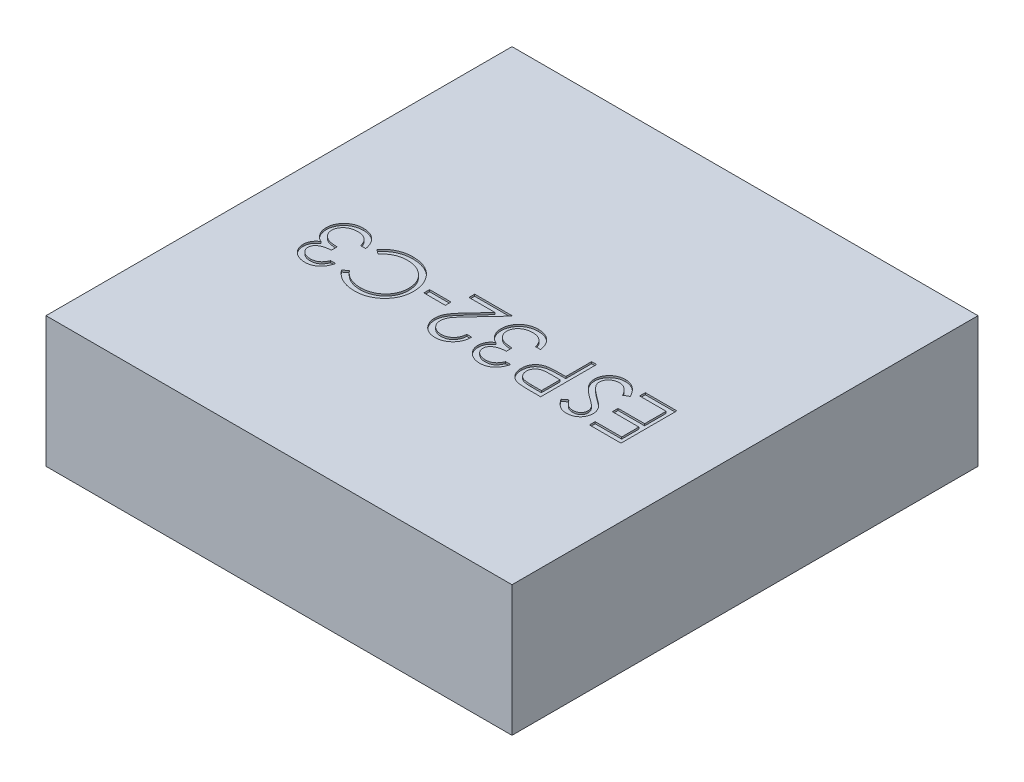
from build123d import *

# Parameters (mm, degrees)
BASES_W          = 5
BASES_H          = 5
BASE_DEPTH       = 1.4
PARTNUMBERS_W    = 0.230769231
PARTNUMBERS_H    = 0.061538462
PARTNUMBER_DEPTH = 0.02


with BuildPart() as part:
    # BaseS → Base (new body)
    with BuildSketch(Plane(origin=(0, 0, 0), x_dir=(1, 0, 0), z_dir=(0, 1, 0))):
        Rectangle(BASES_W, BASES_H)
    extrude(amount=BASE_DEPTH)

    # PartNumberS → PartNumber (cut)
    # profile 1 of 8: a face of its own
    with BuildSketch(Plane(origin=(0, 1.4, 0), x_dir=(1, 0, 0), z_dir=(0, 1, 0))):
        Polygon((1.769230769, -0.6), (1.430769231, -0.6), (1.430769231, -0.538461538), (1.715384615, -0.538461538), (1.715384615, -0.353846154), (1.430769231, -0.353846154), (1.430769231, -0.292307692), (1.715384615, -0.292307692), (1.715384615, -0.061538462), (1.430769231, -0.061538462), (1.430769231, 0), (1.769230769, 0), align=None)
    # profile 2 of 8: a face of its own
    with BuildSketch(Plane(origin=(0, 1.4, 0), x_dir=(1, 0, 0), z_dir=(0, 1, 0))):
        with BuildLine():
            Line((1.384615385, -0.115745192), (1.333894231, -0.146153846))
            add(Edge.make_bspline(
                [(1.333894231, -0.146153846), (1.329176819, -0.138257094), (1.320138439, -0.123127223), (1.305061063, -0.102682987), (1.289438279, -0.085306618), (1.273154393, -0.071099199), (1.256308802, -0.059913676), (1.238791535, -0.051993293), (1.220661625, -0.047053412), (1.208323255, -0.046453397), (1.202163462, -0.046153846)],
                knots=[0, 0, 0, 0, 1.272034388, 2.437168799, 3.508375237, 4.49857839, 5.41946034, 6.295179144, 7.148887113, 8, 8, 8, 8], degree=3))
            add(Edge.make_bspline(
                [(1.202163462, -0.046153846), (1.196903921, -0.046303847), (1.186476871, -0.046601224), (1.171096496, -0.049343192), (1.156233778, -0.053829033), (1.142036643, -0.059910127), (1.128880563, -0.06738493), (1.117160746, -0.076199768), (1.107258313, -0.086382722), (1.099071687, -0.097566638), (1.092663061, -0.109518059), (1.08810317, -0.121942657), (1.085173996, -0.134761256), (1.084802618, -0.143454003), (1.084615385, -0.147836538)],
                knots=[0, 0, 0, 0, 1.095645842, 2.172120455, 3.244862764, 4.326153987, 5.384857088, 6.392105572, 7.372507978, 8.334705661, 9.272564127, 10.189475455, 11.087205874, 12, 12, 12, 12], degree=3))
            add(Edge.make_bspline(
                [(1.084615385, -0.147836538), (1.084862695, -0.15283378), (1.085363526, -0.162953739), (1.089777384, -0.177910096), (1.096517161, -0.192775056), (1.102851793, -0.201971722), (1.106129808, -0.206730769)],
                knots=[0, 0, 0, 0, 0.938992559, 1.901562324, 2.914110574, 4, 4, 4, 4], degree=3))
            add(Edge.make_bspline(
                [(1.106129808, -0.206730769), (1.108808199, -0.210174828), (1.114447651, -0.217426423), (1.124285468, -0.228031117), (1.135471687, -0.23925953), (1.148295921, -0.250887546), (1.162571166, -0.263153024), (1.178459264, -0.275828487), (1.195774696, -0.289102984), (1.207987774, -0.297870407), (1.214302885, -0.302403846)],
                knots=[0, 0, 0, 0, 0.722283655, 1.520795216, 2.39349503, 3.346893347, 4.386874146, 5.510198126, 6.712579003, 8, 8, 8, 8], degree=3))
            add(Edge.make_bspline(
                [(1.214302885, -0.302403846), (1.220614728, -0.306901205), (1.232682491, -0.315499812), (1.249571991, -0.328244955), (1.264654673, -0.339971896), (1.27800739, -0.350517281), (1.28928469, -0.360341047), (1.298898841, -0.368916696), (1.30649514, -0.376702156), (1.310722301, -0.381748665), (1.312620192, -0.384014423)],
                knots=[0, 0, 0, 0, 1.452255772, 2.776602448, 3.96446981, 5.032613149, 5.964194703, 6.766668629, 7.446264616, 8, 8, 8, 8], degree=3))
            add(Edge.make_bspline(
                [(1.312620192, -0.384014423), (1.315272184, -0.387546205), (1.320487682, -0.394491927), (1.327379618, -0.405345119), (1.333191606, -0.416433991), (1.33786917, -0.427798731), (1.341651739, -0.439353928), (1.344281595, -0.451186332), (1.345902583, -0.463215619), (1.346070026, -0.471309081), (1.346153846, -0.475360577)],
                knots=[0, 0, 0, 0, 1.068019517, 2.100403715, 3.106014851, 4.09224787, 5.069873182, 6.043214339, 7.020455327, 8, 8, 8, 8], degree=3))
            add(Edge.make_bspline(
                [(1.346153846, -0.475360577), (1.345931082, -0.481709082), (1.345490315, -0.494270398), (1.341731921, -0.512610649), (1.335869839, -0.53017497), (1.32738875, -0.546572444), (1.316913018, -0.561779825), (1.304478304, -0.575527348), (1.289851741, -0.587341806), (1.273568642, -0.59738504), (1.255953684, -0.6053973), (1.237441396, -0.611235535), (1.218114963, -0.614657097), (1.204981368, -0.615139727), (1.198317308, -0.615384615)],
                knots=[0, 0, 0, 0, 1.005367131, 1.989245246, 2.955191616, 3.932180104, 4.904534562, 5.875498653, 6.859376768, 7.874484044, 8.900379497, 9.918679785, 10.943926428, 12, 12, 12, 12], degree=3))
            add(Edge.make_bspline(
                [(1.198317308, -0.615384615), (1.191244705, -0.61514861), (1.177218889, -0.614680582), (1.156581543, -0.610360924), (1.136593341, -0.603649303), (1.120574367, -0.595655893), (1.108032547, -0.587758416), (1.098478119, -0.580546834), (1.088743297, -0.572262478), (1.07893297, -0.562729845), (1.068950209, -0.55213985), (1.058841021, -0.540402772), (1.048510795, -0.527624405), (1.041867307, -0.518499815), (1.038461538, -0.513822115)],
                knots=[0, 0, 0, 0, 1.286534051, 2.551350862, 3.822568981, 5.117864672, 5.799956111, 6.519305446, 7.295594771, 8.126302591, 9.008831062, 9.944975596, 10.946496709, 12, 12, 12, 12], degree=3))
            Line((1.038461538, -0.513822115), (1.087139423, -0.476923077))
            add(Edge.make_bspline(
                [(1.087139423, -0.476923077), (1.090078511, -0.480709929), (1.095738509, -0.48800252), (1.104334986, -0.498211829), (1.112425093, -0.507550252), (1.120456807, -0.515640046), (1.127811016, -0.523087098), (1.135075558, -0.529349613), (1.141969792, -0.534626408), (1.150640059, -0.540265114), (1.161651322, -0.545720603), (1.175344867, -0.550411024), (1.189664456, -0.553293566), (1.199385708, -0.553659933), (1.204326923, -0.553846154)],
                knots=[0, 0, 0, 0, 1.181426797, 2.275151783, 3.28963443, 4.225459815, 5.084396437, 5.868484344, 6.587427557, 7.222918358, 8.415355282, 9.605213164, 10.782753814, 12, 12, 12, 12], degree=3))
            add(Edge.make_bspline(
                [(1.204326923, -0.553846154), (1.210526647, -0.553641835), (1.22248223, -0.553247826), (1.239416114, -0.548831419), (1.254745505, -0.54211657), (1.267885206, -0.532433827), (1.278734453, -0.520890133), (1.286679773, -0.507725363), (1.291430139, -0.493185387), (1.292011576, -0.483047618), (1.292307692, -0.477884615)],
                knots=[0, 0, 0, 0, 1.144248881, 2.206576175, 3.214949548, 4.222996039, 5.203671638, 6.127710127, 7.046472867, 8, 8, 8, 8], degree=3))
            add(Edge.make_bspline(
                [(1.292307692, -0.477884615), (1.292233265, -0.474671658), (1.292083372, -0.468200986), (1.290296291, -0.458660661), (1.287629447, -0.449232647), (1.283849269, -0.439862626), (1.278711963, -0.430283654), (1.271734599, -0.420550329), (1.263003352, -0.410419051), (1.25630235, -0.40383615), (1.252764423, -0.400360577)],
                knots=[0, 0, 0, 0, 0.858500039, 1.728959331, 2.587258638, 3.476905708, 4.426389682, 5.487945037, 6.673710648, 8, 8, 8, 8], degree=3))
            add(Edge.make_bspline(
                [(1.252764423, -0.400360577), (1.251451045, -0.399188515), (1.248330759, -0.396403965), (1.242626315, -0.391845289), (1.235093264, -0.386221956), (1.225928315, -0.379264131), (1.214962481, -0.371193023), (1.202194557, -0.362111832), (1.187766866, -0.351725753), (1.177528823, -0.344464461), (1.172115385, -0.340625)],
                knots=[0, 0, 0, 0, 0.420754252, 0.999615792, 1.744751191, 2.668019286, 3.750313428, 4.999500688, 6.413464383, 8, 8, 8, 8], degree=3))
            add(Edge.make_bspline(
                [(1.172115385, -0.340625), (1.165603518, -0.335886478), (1.152994192, -0.326710987), (1.13505283, -0.312925487), (1.118785533, -0.299442857), (1.104133983, -0.286350074), (1.090957465, -0.273743523), (1.079388806, -0.261481311), (1.069375515, -0.249643851), (1.058448272, -0.234570693), (1.047414996, -0.215886962), (1.037954868, -0.192985549), (1.031936497, -0.170018417), (1.031154876, -0.15460169), (1.030769231, -0.146995192)],
                knots=[0, 0, 0, 0, 1.163604038, 2.253157948, 3.268574773, 4.215621239, 5.091738613, 5.902582348, 6.650434646, 7.330118262, 8.591011492, 9.77460283, 10.902005569, 12, 12, 12, 12], degree=3))
            add(Edge.make_bspline(
                [(1.030769231, -0.146995192), (1.03088206, -0.141616143), (1.031105529, -0.130962503), (1.033667677, -0.11531733), (1.03743493, -0.100128843), (1.043049568, -0.085586056), (1.050068028, -0.071526888), (1.058612948, -0.057975991), (1.068968418, -0.045156019), (1.080472102, -0.032818007), (1.093249785, -0.021659494), (1.106771182, -0.011720783), (1.120960401, -0.003211036), (1.135979481, 0.00347441), (1.151581016, 0.008822196), (1.167838241, 0.012655347), (1.184786089, 0.015015926), (1.196306338, 0.015260347), (1.202163462, 0.015384615)],
                knots=[0, 0, 0, 0, 0.98378539, 1.948466333, 2.894822735, 3.844243623, 4.795447569, 5.768042124, 6.770299647, 7.807997672, 8.852593179, 9.870666288, 10.876941106, 11.874841786, 12.874492863, 13.892063892, 14.928283473, 16, 16, 16, 16], degree=3))
            add(Edge.make_bspline(
                [(1.202163462, 0.015384615), (1.206695035, 0.01529598), (1.21570111, 0.015119826), (1.22898643, 0.013599404), (1.24202779, 0.011369685), (1.254661445, 0.007970174), (1.267044691, 0.003748512), (1.279067203, -0.001420264), (1.290757982, -0.007573575), (1.302131471, -0.014720938), (1.313291769, -0.02296017), (1.324193834, -0.032473231), (1.334892242, -0.043214587), (1.345431432, -0.055169289), (1.355563141, -0.068534941), (1.36554215, -0.083099578), (1.3753165, -0.098910254), (1.381457862, -0.110028732), (1.384615385, -0.115745192)],
                knots=[0, 0, 0, 0, 0.915366252, 1.81920441, 2.69897508, 3.586533125, 4.459536084, 5.340758185, 6.227946952, 7.126403341, 8.052553006, 9.028121456, 10.047063623, 11.114014537, 12.24582441, 13.433687931, 14.680555077, 16, 16, 16, 16], degree=3))
        make_face()
    # profile 3 of 8: a face of its own
    with BuildSketch(Plane(origin=(0, 1.4, 0), x_dir=(1, 0, 0), z_dir=(0, 1, 0))):
        with BuildLine():
            Line((0.907692308, -0.6), (0.790024038, -0.6))
            add(Edge.make_bspline(
                [(0.790024038, -0.6), (0.78193074, -0.599991104), (0.766423621, -0.599974057), (0.744186755, -0.599457244), (0.723990801, -0.598766954), (0.705879307, -0.597810058), (0.689796547, -0.596679214), (0.675815296, -0.59509315), (0.663825658, -0.593437099), (0.656641695, -0.59175343), (0.653365385, -0.590985577)],
                knots=[0, 0, 0, 0, 1.415646017, 2.712440637, 3.8905458, 4.950247383, 5.884950622, 6.709939814, 7.411656543, 8, 8, 8, 8], degree=3))
            add(Edge.make_bspline(
                [(0.653365385, -0.590985577), (0.649217948, -0.589850351), (0.641020804, -0.58760665), (0.629208815, -0.583113365), (0.617972429, -0.577783154), (0.607264643, -0.57171728), (0.597268895, -0.564629283), (0.587673098, -0.556928259), (0.57867849, -0.54830276), (0.570420887, -0.538764143), (0.562769861, -0.528624888), (0.556365404, -0.51762645), (0.550710016, -0.50615037), (0.546302721, -0.493916455), (0.542838418, -0.481086191), (0.540315362, -0.467626186), (0.53869374, -0.453565475), (0.538539869, -0.443954881), (0.538461538, -0.4390625)],
                knots=[0, 0, 0, 0, 0.999333726, 1.975119402, 2.933498163, 3.889020618, 4.832249799, 5.779334906, 6.747801194, 7.724875447, 8.710438469, 9.696133548, 10.679360639, 11.681339199, 12.714023775, 13.766351759, 14.862936069, 16, 16, 16, 16], degree=3))
            add(Edge.make_bspline(
                [(0.538461538, -0.4390625), (0.538533783, -0.434129167), (0.538675133, -0.424476767), (0.540371639, -0.410355718), (0.542656815, -0.396861137), (0.546170596, -0.384022945), (0.550772711, -0.371917385), (0.556171349, -0.360359459), (0.562682811, -0.349545801), (0.570164782, -0.339437152), (0.578487912, -0.330024024), (0.587616987, -0.321374631), (0.597515152, -0.313539602), (0.608150949, -0.306501371), (0.619628066, -0.300423152), (0.631772435, -0.294979043), (0.644689615, -0.290406861), (0.653628331, -0.288001707), (0.658173077, -0.286778846)],
                knots=[0, 0, 0, 0, 1.121902311, 2.195077645, 3.232258892, 4.234102512, 5.217864754, 6.176164875, 7.132989551, 8.084763148, 9.034132444, 9.988522005, 10.94243251, 11.903244335, 12.886203696, 13.894208494, 14.929344452, 16, 16, 16, 16], degree=3))
            add(Edge.make_bspline(
                [(0.658173077, -0.286778846), (0.661932091, -0.285980074), (0.67017019, -0.284229517), (0.683736663, -0.282261941), (0.699540084, -0.280648314), (0.717526682, -0.279142464), (0.737738403, -0.278344551), (0.760128889, -0.277407672), (0.784773919, -0.27696561), (0.801963058, -0.276937666), (0.8109375, -0.276923077)],
                knots=[0, 0, 0, 0, 0.601372724, 1.317943291, 2.144091499, 3.08771165, 4.142394186, 5.309582461, 6.595334295, 8, 8, 8, 8], degree=3))
            Line((0.8109375, -0.276923077), (0.853846154, -0.276923077))
            Line((0.853846154, -0.276923077), (0.853846154, 0))
            Line((0.853846154, 0), (0.907692308, 0))
            Line((0.907692308, 0), (0.907692308, -0.6))
        make_face()
        with BuildLine():
            Line((0.853846154, -0.538461538), (0.853846154, -0.338461538))
            Line((0.853846154, -0.338461538), (0.748798077, -0.337139423))
            add(Edge.make_bspline(
                [(0.748798077, -0.337139423), (0.74366886, -0.337136041), (0.733767014, -0.337129512), (0.719424871, -0.337824408), (0.706150706, -0.338580377), (0.693924919, -0.339802958), (0.682803313, -0.341294125), (0.67275896, -0.343287823), (0.663711702, -0.345321267), (0.653290263, -0.348849652), (0.641617158, -0.35417267), (0.628947706, -0.36212326), (0.618122698, -0.372139004), (0.608834321, -0.383522001), (0.601492493, -0.396198445), (0.596171552, -0.409723844), (0.59292376, -0.424046841), (0.59251554, -0.433837254), (0.592307692, -0.438822115)],
                knots=[0, 0, 0, 0, 1.160501667, 2.240324542, 3.248665471, 4.168823117, 5.020172044, 5.786515869, 6.485785279, 7.116517804, 8.272762037, 9.381837012, 10.485674779, 11.594342068, 12.695271952, 13.786226926, 14.872841088, 16, 16, 16, 16], degree=3))
            add(Edge.make_bspline(
                [(0.592307692, -0.438822115), (0.592524813, -0.443645481), (0.592956423, -0.453233735), (0.596144724, -0.467292837), (0.601548843, -0.480664473), (0.608840306, -0.493240445), (0.617906101, -0.504593187), (0.628515822, -0.514385717), (0.640504399, -0.522311623), (0.651569357, -0.527587824), (0.661471623, -0.530681905), (0.670031232, -0.532915675), (0.679745078, -0.534456259), (0.690521233, -0.535930308), (0.702345899, -0.537120186), (0.715294267, -0.537946475), (0.729323206, -0.538424987), (0.739062116, -0.53844906), (0.744110577, -0.538461538)],
                knots=[0, 0, 0, 0, 1.12039168, 2.227199994, 3.330242575, 4.460839274, 5.593542475, 6.693949254, 7.801736126, 8.92216649, 9.528704869, 10.210659466, 10.975987387, 11.81211542, 12.738540127, 13.736887663, 14.826846554, 16, 16, 16, 16], degree=3))
            Line((0.744110577, -0.538461538), (0.853846154, -0.538461538))
        make_face(mode=Mode.SUBTRACT)
    # profile 4 of 8: a face of its own
    with BuildSketch(Plane(origin=(0, 1.4, 0), x_dir=(1, 0, 0), z_dir=(0, 1, 0))):
        with BuildLine():
            Line((0.392307692, -0.461538462), (0.446153846, -0.461538462))
            add(Edge.make_bspline(
                [(0.446153846, -0.461538462), (0.444695066, -0.467578316), (0.44184327, -0.479385737), (0.435895115, -0.496255553), (0.429415242, -0.512219586), (0.421634253, -0.526978913), (0.413147038, -0.540830153), (0.403423143, -0.553459146), (0.392911191, -0.565187083), (0.381284056, -0.575595066), (0.369090572, -0.58501982), (0.356158922, -0.593055544), (0.342749283, -0.599968256), (0.328768746, -0.605663153), (0.314175688, -0.609953243), (0.299102039, -0.613065838), (0.283508296, -0.615087172), (0.272922995, -0.615284445), (0.267548077, -0.615384615)],
                knots=[0, 0, 0, 0, 1.162005537, 2.271625781, 3.343758855, 4.383309926, 5.390229558, 6.379919256, 7.361854164, 8.333198761, 9.295911338, 10.242430842, 11.177959212, 12.116337295, 13.062827104, 14.020064771, 14.994644689, 16, 16, 16, 16], degree=3))
            add(Edge.make_bspline(
                [(0.267548077, -0.615384615), (0.25971675, -0.615148176), (0.244224919, -0.614680454), (0.22146554, -0.610409408), (0.199518085, -0.603650814), (0.178622785, -0.594312461), (0.159213911, -0.582794636), (0.141944851, -0.569086395), (0.127049677, -0.553452229), (0.114553498, -0.53618379), (0.104769213, -0.517728559), (0.097554406, -0.498734247), (0.093162118, -0.479245909), (0.092592879, -0.466087518), (0.092307692, -0.459495192)],
                knots=[0, 0, 0, 0, 1.083050992, 2.142477498, 3.193116406, 4.255571735, 5.30263384, 6.308962982, 7.297363603, 8.282367274, 9.249857812, 10.179914175, 11.08814088, 12, 12, 12, 12], degree=3))
            add(Edge.make_bspline(
                [(0.092307692, -0.459495192), (0.092507165, -0.45315117), (0.092897502, -0.440736904), (0.096211852, -0.422613219), (0.101789497, -0.405531801), (0.109515742, -0.389420745), (0.11951715, -0.374382201), (0.13163247, -0.360382334), (0.145947212, -0.34735905), (0.15679503, -0.339898569), (0.162379808, -0.336057692)],
                knots=[0, 0, 0, 0, 1.024540389, 2.004866551, 2.965041327, 3.920577974, 4.882998113, 5.874504559, 6.905732034, 8, 8, 8, 8], degree=3))
            add(Edge.make_bspline(
                [(0.162379808, -0.336057692), (0.155989086, -0.332986893), (0.143306697, -0.32689289), (0.126194453, -0.314751726), (0.110423284, -0.301077761), (0.101731378, -0.290287643), (0.097355769, -0.284855769)],
                knots=[0, 0, 0, 0, 1.015663554, 2.015584519, 3.001021554, 4, 4, 4, 4], degree=3))
            add(Edge.make_bspline(
                [(0.097355769, -0.284855769), (0.094467507, -0.280903433), (0.088738279, -0.273063483), (0.0816865, -0.260451084), (0.075216017, -0.247740645), (0.070453929, -0.234432406), (0.066344435, -0.220953852), (0.063640525, -0.207016353), (0.061904723, -0.192752328), (0.061660981, -0.183098036), (0.061538462, -0.178245192)],
                knots=[0, 0, 0, 0, 1.02516404, 2.033540309, 3.025129118, 4.011046665, 4.991655828, 5.976607087, 6.982917762, 8, 8, 8, 8], degree=3))
            add(Edge.make_bspline(
                [(0.061538462, -0.178245192), (0.061846814, -0.169843903), (0.062462068, -0.153080861), (0.067937657, -0.128308109), (0.076478882, -0.104137356), (0.088382497, -0.080911389), (0.103176887, -0.059246716), (0.120680663, -0.039806927), (0.140912463, -0.023249456), (0.163283224, -0.00929254), (0.187613475, 0.00176816), (0.213533191, 0.00973829), (0.240888911, 0.01451925), (0.25959625, 0.015092876), (0.269110577, 0.015384615)],
                knots=[0, 0, 0, 0, 0.955619592, 1.906742024, 2.874954321, 3.868585453, 4.869520953, 5.854611167, 6.836527075, 7.836578462, 8.849204403, 9.870874567, 10.917152508, 12, 12, 12, 12], degree=3))
            add(Edge.make_bspline(
                [(0.269110577, 0.015384615), (0.27552491, 0.015234481), (0.28814618, 0.014939066), (0.306707958, 0.012955508), (0.324388499, 0.009234208), (0.341359485, 0.004554159), (0.357364784, -0.001916533), (0.372634618, -0.009630797), (0.387102053, -0.018786454), (0.400681171, -0.029398903), (0.413357466, -0.041277952), (0.424807988, -0.054620946), (0.435159423, -0.069178858), (0.444346001, -0.085082639), (0.452406383, -0.102287746), (0.459167111, -0.120863121), (0.465070062, -0.140664761), (0.467819901, -0.15446033), (0.469230769, -0.161538462)],
                knots=[0, 0, 0, 0, 1.048603596, 2.063302207, 3.045874044, 3.999447474, 4.937100059, 5.862643889, 6.7929026, 7.7308982, 8.676022965, 9.627908155, 10.600123445, 11.591992905, 12.626222643, 13.701663232, 14.820785756, 16, 16, 16, 16], degree=3))
            Line((0.469230769, -0.161538462), (0.415384615, -0.161538462))
            add(Edge.make_bspline(
                [(0.415384615, -0.161538462), (0.413981765, -0.156918631), (0.4112531, -0.147932658), (0.406608364, -0.135000035), (0.40131666, -0.123144368), (0.395639878, -0.11227869), (0.389677859, -0.102295993), (0.383006729, -0.093460244), (0.37612059, -0.085383352), (0.370929844, -0.080832847), (0.368389423, -0.078605769)],
                knots=[0, 0, 0, 0, 1.198163088, 2.33053128, 3.407730985, 4.417276592, 5.372219308, 6.28897303, 7.162600585, 8, 8, 8, 8], degree=3))
            add(Edge.make_bspline(
                [(0.368389423, -0.078605769), (0.365029635, -0.076016837), (0.358320429, -0.070846964), (0.347394364, -0.064230657), (0.335863286, -0.058567256), (0.323631036, -0.053963806), (0.310695971, -0.050508291), (0.297110563, -0.048021174), (0.28285252, -0.04637929), (0.273121684, -0.04623009), (0.268149038, -0.046153846)],
                knots=[0, 0, 0, 0, 0.946083416, 1.889246487, 2.84504177, 3.809995578, 4.801312957, 5.829064617, 6.89060985, 8, 8, 8, 8], degree=3))
            add(Edge.make_bspline(
                [(0.268149038, -0.046153846), (0.262534076, -0.046259258), (0.251554502, -0.046465382), (0.235534731, -0.048366474), (0.22028966, -0.051123116), (0.205974866, -0.05543504), (0.192395558, -0.060607905), (0.179854867, -0.067380136), (0.167984111, -0.075028275), (0.157131049, -0.083924531), (0.147346483, -0.093540422), (0.138891537, -0.103742025), (0.131568587, -0.114213024), (0.125682157, -0.125197687), (0.121025714, -0.136588262), (0.117857716, -0.148427386), (0.115654453, -0.160615364), (0.115475053, -0.168900347), (0.115384615, -0.173076923)],
                knots=[0, 0, 0, 0, 1.216990249, 2.379719373, 3.493992396, 4.571561497, 5.616923107, 6.638958652, 7.655775068, 8.674704564, 9.676001865, 10.625896028, 11.54399481, 12.441854662, 13.322657739, 14.20572845, 15.095482574, 16, 16, 16, 16], degree=3))
            add(Edge.make_bspline(
                [(0.115384615, -0.173076923), (0.1156475, -0.178667087), (0.116171962, -0.189819599), (0.120159519, -0.206233587), (0.126777141, -0.222054514), (0.135861395, -0.237075191), (0.147184759, -0.250833589), (0.16021198, -0.263148839), (0.175221016, -0.273403179), (0.189113531, -0.280468285), (0.201451058, -0.285175486), (0.211987931, -0.288476322), (0.223794826, -0.291114887), (0.236729873, -0.293667197), (0.250847666, -0.295806885), (0.266160911, -0.29759896), (0.282675774, -0.299030648), (0.294108522, -0.299670351), (0.3, -0.3)],
                knots=[0, 0, 0, 0, 1.070440979, 2.135555593, 3.216243406, 4.345886539, 5.486149072, 6.621334998, 7.769144672, 8.957074012, 9.598644492, 10.297969361, 11.070758978, 11.915404831, 12.824182859, 13.805940418, 14.869366021, 16, 16, 16, 16], degree=3))
            Line((0.3, -0.3), (0.3, -0.361538462))
            add(Edge.make_bspline(
                [(0.3, -0.361538462), (0.29257983, -0.36168313), (0.278050622, -0.361966402), (0.256767505, -0.364686989), (0.236478043, -0.369102886), (0.217487419, -0.375268052), (0.200267678, -0.382773655), (0.185185628, -0.391177062), (0.172783849, -0.400871727), (0.162840225, -0.411399368), (0.155464931, -0.422762207), (0.150020925, -0.434551438), (0.14680091, -0.446986382), (0.146370294, -0.455470881), (0.146153846, -0.459735577)],
                knots=[0, 0, 0, 0, 1.321816535, 2.58820849, 3.816448615, 5.017641336, 6.139869627, 7.160068286, 8.085608132, 8.934319198, 9.728416342, 10.48890201, 11.240453369, 12, 12, 12, 12], degree=3))
            add(Edge.make_bspline(
                [(0.146153846, -0.459735577), (0.146223325, -0.462869434), (0.14636155, -0.469104093), (0.148174365, -0.478241235), (0.150772595, -0.487099177), (0.154547298, -0.49557442), (0.159429135, -0.503693905), (0.165335432, -0.511487288), (0.17228115, -0.519028989), (0.180221183, -0.526152676), (0.189082464, -0.53256412), (0.198509335, -0.538279833), (0.208538548, -0.543085934), (0.219104745, -0.547069865), (0.230265041, -0.550061465), (0.241960725, -0.552210864), (0.254215839, -0.553554352), (0.262576696, -0.55374781), (0.266826923, -0.553846154)],
                knots=[0, 0, 0, 0, 0.884246871, 1.759167212, 2.622361933, 3.489113179, 4.372562419, 5.294145153, 6.247651513, 7.265905295, 8.30305477, 9.334068495, 10.37719476, 11.441246459, 12.52060732, 13.637552802, 14.799054011, 16, 16, 16, 16], degree=3))
            add(Edge.make_bspline(
                [(0.266826923, -0.553846154), (0.273658863, -0.553608097), (0.287003232, -0.553143118), (0.306236929, -0.549056155), (0.324098797, -0.542580784), (0.337705937, -0.534761792), (0.347770979, -0.527069999), (0.355101259, -0.52045275), (0.362168401, -0.512950144), (0.368695082, -0.504356394), (0.375072396, -0.494967005), (0.381239448, -0.484730262), (0.386998153, -0.473500221), (0.390503571, -0.465602933), (0.392307692, -0.461538462)],
                knots=[0, 0, 0, 0, 1.4727372, 2.876598283, 4.222346151, 5.558423782, 6.24313385, 6.953189256, 7.68715613, 8.463578749, 9.278833271, 10.135787152, 11.040551781, 12, 12, 12, 12], degree=3))
        make_face()
    # profile 5 of 8: a face of its own
    with BuildSketch(Plane(origin=(0, 1.4, 0), x_dir=(1, 0, 0), z_dir=(0, 1, 0))):
        with BuildLine():
            Line((-0.069230769, -0.415384615), (-0.015384615, -0.415384615))
            add(Edge.make_bspline(
                [(-0.015384615, -0.415384615), (-0.015735496, -0.422528231), (-0.016424617, -0.436558103), (-0.019653169, -0.457013132), (-0.024268546, -0.476567186), (-0.030809612, -0.495052627), (-0.038887256, -0.512690277), (-0.048776631, -0.52924593), (-0.060266911, -0.544883898), (-0.073337015, -0.559308103), (-0.087519283, -0.57249363), (-0.102728741, -0.584000501), (-0.118809064, -0.593611447), (-0.135620778, -0.601689669), (-0.153358316, -0.607745992), (-0.171852126, -0.612241659), (-0.1911858, -0.614946031), (-0.20435836, -0.615236757), (-0.211057692, -0.615384615)],
                knots=[0, 0, 0, 0, 1.100776268, 2.161895295, 3.184016182, 4.190939212, 5.176500551, 6.166955529, 7.155448256, 8.160289653, 9.16017456, 10.133824356, 11.091467644, 12.04088621, 13.000931625, 13.972173743, 14.968683325, 16, 16, 16, 16], degree=3))
            add(Edge.make_bspline(
                [(-0.211057692, -0.615384615), (-0.217637254, -0.615231844), (-0.230565857, -0.614931654), (-0.249427081, -0.612314939), (-0.267425212, -0.608305056), (-0.284356278, -0.602363041), (-0.300394039, -0.594907113), (-0.31533992, -0.585634688), (-0.329555329, -0.574984508), (-0.342342599, -0.562422099), (-0.354089248, -0.549017977), (-0.36421415, -0.534702486), (-0.372933795, -0.519899829), (-0.380070552, -0.504494373), (-0.385480531, -0.488435953), (-0.389488807, -0.471878524), (-0.391780155, -0.454631004), (-0.392129886, -0.442955258), (-0.392307692, -0.437019231)],
                knots=[0, 0, 0, 0, 1.111674182, 2.184400057, 3.212814286, 4.223731311, 5.211378316, 6.196328225, 7.191884489, 8.207283132, 9.220262353, 10.201199469, 11.166417575, 12.120932471, 13.06540007, 14.026332106, 14.996573967, 16, 16, 16, 16], degree=3))
            add(Edge.make_bspline(
                [(-0.392307692, -0.437019231), (-0.392017414, -0.428662463), (-0.391441952, -0.412095576), (-0.386519554, -0.387750118), (-0.378831326, -0.364162876), (-0.369575457, -0.345178691), (-0.360235487, -0.329882969), (-0.351827237, -0.317283009), (-0.34192801, -0.30371981), (-0.330622381, -0.289138475), (-0.31771565, -0.273729958), (-0.303543134, -0.257179885), (-0.287738821, -0.239794278), (-0.276656199, -0.227911939), (-0.270913462, -0.221754808)],
                knots=[0, 0, 0, 0, 1.184416499, 2.348048165, 3.509039915, 4.696071444, 5.333504901, 6.05069495, 6.844171097, 7.714965912, 8.667477798, 9.695072654, 10.805644396, 12, 12, 12, 12], degree=3))
            Line((-0.270913462, -0.221754808), (-0.120793269, -0.061538462))
            Line((-0.120793269, -0.061538462), (-0.4, -0.061538462))
            Line((-0.4, -0.061538462), (-0.4, 0))
            Line((-0.4, 0), (0.007692308, 0))
            Line((0.007692308, 0), (-0.225, -0.248317308))
            add(Edge.make_bspline(
                [(-0.225, -0.248317308), (-0.230665753, -0.254230981), (-0.241548505, -0.265589936), (-0.256934527, -0.282178687), (-0.270775877, -0.29755023), (-0.283081738, -0.311772681), (-0.293862233, -0.32476541), (-0.303082871, -0.336630239), (-0.310784405, -0.347265348), (-0.318946426, -0.35975903), (-0.326729455, -0.375031178), (-0.333569941, -0.393600662), (-0.337711078, -0.412758764), (-0.338210384, -0.425701321), (-0.338461538, -0.432211538)],
                knots=[0, 0, 0, 0, 1.329530082, 2.553755191, 3.672934919, 4.687409497, 5.60679272, 6.413407421, 7.126401618, 7.737995624, 8.834647426, 9.90044882, 10.943907757, 12, 12, 12, 12], degree=3))
            add(Edge.make_bspline(
                [(-0.338461538, -0.432211538), (-0.338353674, -0.436305945), (-0.338141093, -0.444375234), (-0.336229425, -0.456198301), (-0.333420805, -0.467647249), (-0.329091855, -0.47858052), (-0.32389078, -0.489213149), (-0.317246024, -0.499221873), (-0.309652813, -0.508947863), (-0.30084506, -0.518057624), (-0.291175784, -0.52640358), (-0.280959295, -0.533796122), (-0.270150793, -0.539974297), (-0.25879532, -0.545038885), (-0.246924674, -0.54901181), (-0.234515859, -0.551764709), (-0.221603171, -0.553493135), (-0.212786, -0.553726993), (-0.208293269, -0.553846154)],
                knots=[0, 0, 0, 0, 0.991504627, 1.954065223, 2.895985987, 3.842598665, 4.797835564, 5.759220273, 6.74786863, 7.784730864, 8.824135544, 9.839918996, 10.835834653, 11.835434876, 12.84861661, 13.863796685, 14.911511676, 16, 16, 16, 16], degree=3))
            add(Edge.make_bspline(
                [(-0.208293269, -0.553846154), (-0.203599928, -0.553728451), (-0.19438298, -0.553497301), (-0.180879541, -0.55174538), (-0.167907537, -0.549092184), (-0.155666865, -0.544868319), (-0.143901348, -0.539924836), (-0.132911131, -0.533523895), (-0.122387485, -0.52620983), (-0.112541991, -0.517682095), (-0.103574873, -0.508055567), (-0.095417406, -0.497577261), (-0.088505503, -0.486061418), (-0.082369876, -0.473784364), (-0.077677333, -0.460408799), (-0.073665546, -0.446261836), (-0.070751441, -0.431141634), (-0.069746079, -0.420724191), (-0.069230769, -0.415384615)],
                knots=[0, 0, 0, 0, 1.031072318, 2.024855787, 2.988461151, 3.935103592, 4.865765533, 5.788564469, 6.724086513, 7.67908574, 8.64457978, 9.611397706, 10.591395687, 11.591555111, 12.622101007, 13.700900657, 14.821571223, 16, 16, 16, 16], degree=3))
        make_face()
    # profile 6 of 8: a face of its own
    with BuildSketch(Plane(origin=(0, 1.4, 0), x_dir=(1, 0, 0), z_dir=(0, 1, 0))):
        with Locations((-0.56923077, -0.230769231)):
            Rectangle(PARTNUMBERS_W, PARTNUMBERS_H)
    # profile 7 of 8: a face of its own
    with BuildSketch(Plane(origin=(0, 1.4, 0), x_dir=(1, 0, 0), z_dir=(0, 1, 0))):
        with BuildLine():
            Line((-1.338461538, -0.489903846), (-1.291346154, -0.453846154))
            add(Edge.make_bspline(
                [(-1.291346154, -0.453846154), (-1.28798511, -0.457851696), (-1.281308336, -0.465808776), (-1.270567265, -0.476983191), (-1.259370804, -0.487448609), (-1.24773453, -0.497272272), (-1.235389154, -0.506059347), (-1.22280507, -0.514494178), (-1.209525041, -0.521879163), (-1.19125455, -0.530900846), (-1.167260438, -0.540109704), (-1.137160179, -0.548030118), (-1.105695181, -0.553024548), (-1.084233556, -0.553569148), (-1.073317308, -0.553846154)],
                knots=[0, 0, 0, 0, 0.75789156, 1.505565099, 2.245254514, 2.979266606, 3.711207489, 4.440978832, 5.174393176, 5.91211879, 7.394186119, 8.890401545, 10.418332761, 12, 12, 12, 12], degree=3))
            add(Edge.make_bspline(
                [(-1.073317308, -0.553846154), (-1.067303101, -0.553776591), (-1.055330505, -0.55363811), (-1.037561116, -0.551824014), (-1.020089882, -0.549244917), (-1.002981772, -0.545511137), (-0.986270754, -0.540650095), (-0.969829589, -0.53494939), (-0.953851905, -0.527855444), (-0.938145433, -0.520021117), (-0.923098224, -0.511169805), (-0.90885814, -0.501518227), (-0.895489405, -0.491161728), (-0.88295802, -0.480124783), (-0.871390258, -0.468278542), (-0.86066323, -0.455756106), (-0.850790627, -0.442500922), (-0.841782635, -0.428576323), (-0.833725555, -0.414051095), (-0.826738757, -0.398987627), (-0.820832862, -0.383443468), (-0.816041627, -0.36745193), (-0.812291811, -0.351069619), (-0.80969614, -0.334237878), (-0.807898757, -0.316986128), (-0.807761497, -0.305293139), (-0.807692308, -0.299399038)],
                knots=[0, 0, 0, 0, 1.054960097, 2.100129169, 3.131228542, 4.15308236, 5.169990287, 6.183953224, 7.204064171, 8.235355279, 9.262684623, 10.264978336, 11.252191258, 12.228402777, 13.192898315, 14.155264692, 15.119862721, 16.091023151, 17.063429752, 18.032246104, 19.00241354, 19.978852882, 20.959535218, 21.948948728, 22.966123959, 24, 24, 24, 24], degree=3))
            add(Edge.make_bspline(
                [(-0.807692308, -0.299399038), (-0.807909127, -0.29053101), (-0.808334822, -0.273119812), (-0.812107336, -0.247613472), (-0.817886089, -0.223154925), (-0.826405068, -0.199909777), (-0.837119035, -0.177684252), (-0.850487111, -0.156747879), (-0.866028285, -0.136793935), (-0.883901987, -0.118305692), (-0.903514931, -0.101417863), (-0.924557293, -0.086546272), (-0.946977493, -0.074149452), (-0.970527763, -0.06383357), (-0.995389385, -0.055903847), (-1.021517636, -0.050321425), (-1.048855693, -0.046679909), (-1.067536161, -0.046331277), (-1.077043269, -0.046153846)],
                knots=[0, 0, 0, 0, 1.029159485, 2.020618137, 2.987588728, 3.942669054, 4.889339625, 5.846988364, 6.821327795, 7.821533711, 8.827683044, 9.822769455, 10.807800696, 11.797391277, 12.803701919, 13.832062008, 14.896664671, 16, 16, 16, 16], degree=3))
            add(Edge.make_bspline(
                [(-1.077043269, -0.046153846), (-1.087518016, -0.046443351), (-1.108134823, -0.047013167), (-1.138369342, -0.051840466), (-1.167312616, -0.059667538), (-1.194966202, -0.070621468), (-1.221252142, -0.084861231), (-1.246211569, -0.102123724), (-1.269865553, -0.122573153), (-1.284089201, -0.138187404), (-1.291346154, -0.146153846)],
                knots=[0, 0, 0, 0, 1.028121516, 2.023589091, 2.998037872, 3.967518031, 4.937445131, 5.927275754, 6.942489185, 8, 8, 8, 8], degree=3))
            Line((-1.291346154, -0.146153846), (-1.338461538, -0.110456731))
            add(Edge.make_bspline(
                [(-1.338461538, -0.110456731), (-1.334669735, -0.105564586), (-1.327104289, -0.095803729), (-1.314856241, -0.082040477), (-1.301944474, -0.069105846), (-1.288334132, -0.057067198), (-1.274007448, -0.04586436), (-1.258970684, -0.035549422), (-1.243298837, -0.026007963), (-1.226972285, -0.01735975), (-1.209990133, -0.009664286), (-1.192497916, -0.002938467), (-1.174463589, 0.002709154), (-1.156029369, 0.007454326), (-1.137005845, 0.010843284), (-1.117610678, 0.013540377), (-1.097663288, 0.015140848), (-1.084217575, 0.015302631), (-1.077403846, 0.015384615)],
                knots=[0, 0, 0, 0, 0.986880684, 1.969034265, 2.935876267, 3.899990983, 4.864973347, 5.834408638, 6.8063673, 7.789580233, 8.778939794, 9.778051223, 10.776304221, 11.791326552, 12.811423977, 13.855999788, 14.91350973, 16, 16, 16, 16], degree=3))
            add(Edge.make_bspline(
                [(-1.077403846, 0.015384615), (-1.070950646, 0.015339702), (-1.058190242, 0.015250892), (-1.039350456, 0.013812235), (-1.021009385, 0.011849423), (-1.003219449, 0.008893972), (-0.985883568, 0.005406371), (-0.969158896, 0.000731298), (-0.95288086, -0.004505702), (-0.937114859, -0.010660842), (-0.921847482, -0.017606473), (-0.907127971, -0.025456455), (-0.892963097, -0.034144775), (-0.879213596, -0.043479919), (-0.866082582, -0.053761742), (-0.853456263, -0.064847451), (-0.841263839, -0.076699682), (-0.833720521, -0.085246228), (-0.829927885, -0.089543269)],
                knots=[0, 0, 0, 0, 1.114604814, 2.203992996, 3.262667896, 4.300477797, 5.318619304, 6.316056647, 7.298880507, 8.271930387, 9.238335007, 10.195173496, 11.151986948, 12.108099108, 13.064862484, 14.031167946, 15.010108607, 16, 16, 16, 16], degree=3))
            add(Edge.make_bspline(
                [(-0.829927885, -0.089543269), (-0.823853599, -0.097007627), (-0.811778362, -0.111846226), (-0.796322411, -0.135892985), (-0.783136312, -0.160977481), (-0.772355852, -0.187245009), (-0.764075201, -0.214705781), (-0.758253365, -0.243315619), (-0.754496543, -0.273017332), (-0.754065338, -0.29321764), (-0.753846154, -0.303485577)],
                knots=[0, 0, 0, 0, 0.994611881, 1.977215934, 2.950189954, 3.921972279, 4.908960509, 5.911694611, 6.938501887, 8, 8, 8, 8], degree=3))
            add(Edge.make_bspline(
                [(-0.753846154, -0.303485577), (-0.754113951, -0.314277489), (-0.754640825, -0.335509902), (-0.759080228, -0.366677596), (-0.766308433, -0.396495481), (-0.776261719, -0.425078292), (-0.789392765, -0.452262486), (-0.805288959, -0.478162875), (-0.824105567, -0.50275831), (-0.845606271, -0.525734337), (-0.869190485, -0.546740523), (-0.894444814, -0.565221733), (-0.921321805, -0.58060184), (-0.949524842, -0.593458336), (-0.979265251, -0.603340241), (-1.010479541, -0.610257931), (-1.04310907, -0.614563722), (-1.0653712, -0.615108043), (-1.076682692, -0.615384615)],
                knots=[0, 0, 0, 0, 1.032901378, 2.032168977, 3.007206631, 3.966850309, 4.924221947, 5.891988639, 6.871730993, 7.884084801, 8.900290346, 9.89161143, 10.874607481, 11.860025555, 12.854717796, 13.869097222, 14.917278314, 16, 16, 16, 16], degree=3))
            add(Edge.make_bspline(
                [(-1.076682692, -0.615384615), (-1.083576593, -0.615301953), (-1.097222374, -0.615138331), (-1.117408675, -0.61354314), (-1.13706116, -0.610883123), (-1.156234498, -0.607257963), (-1.174960316, -0.60274896), (-1.193154457, -0.597103093), (-1.210764791, -0.590276867), (-1.227910065, -0.582679446), (-1.244370447, -0.573978348), (-1.26013775, -0.564520646), (-1.275083945, -0.554124216), (-1.289306191, -0.542940687), (-1.302738734, -0.530884025), (-1.315583168, -0.518156888), (-1.327458114, -0.504421663), (-1.334787016, -0.494751977), (-1.338461538, -0.489903846)],
                knots=[0, 0, 0, 0, 1.096566765, 2.170543479, 3.218870886, 4.250164525, 5.273529809, 6.281496242, 7.278154839, 8.276706968, 9.263143576, 10.238168486, 11.199979644, 12.157579042, 13.114563119, 14.070017788, 15.032356758, 16, 16, 16, 16], degree=3))
        make_face()
    # profile 8 of 8: a face of its own
    with BuildSketch(Plane(origin=(0, 1.4, 0), x_dir=(1, 0, 0), z_dir=(0, 1, 0))):
        with BuildLine():
            Line((-1.484615385, -0.461538462), (-1.430769231, -0.461538462))
            add(Edge.make_bspline(
                [(-1.430769231, -0.461538462), (-1.432228011, -0.467578316), (-1.435079807, -0.479385737), (-1.441027962, -0.496255553), (-1.447507834, -0.512219586), (-1.455288824, -0.526978913), (-1.463776039, -0.540830153), (-1.473499934, -0.553459146), (-1.484011886, -0.565187083), (-1.495639021, -0.575595066), (-1.507832505, -0.58501982), (-1.520764155, -0.593055544), (-1.534173793, -0.599968256), (-1.548154331, -0.605663153), (-1.562747389, -0.609953243), (-1.577821038, -0.613065838), (-1.593414781, -0.615087172), (-1.604000082, -0.615284445), (-1.609375, -0.615384615)],
                knots=[0, 0, 0, 0, 1.162005537, 2.271625781, 3.343758855, 4.383309926, 5.390229558, 6.379919256, 7.361854164, 8.333198761, 9.295911338, 10.242430842, 11.177959212, 12.116337295, 13.062827104, 14.020064771, 14.994644689, 16, 16, 16, 16], degree=3))
            add(Edge.make_bspline(
                [(-1.609375, -0.615384615), (-1.617206327, -0.615148176), (-1.632698158, -0.614680454), (-1.655457537, -0.610409408), (-1.677404992, -0.603650814), (-1.698300291, -0.594312461), (-1.717709166, -0.582794636), (-1.734978226, -0.569086395), (-1.749873399, -0.553452229), (-1.762369579, -0.53618379), (-1.772153864, -0.517728559), (-1.779368671, -0.498734247), (-1.783760959, -0.479245909), (-1.784330197, -0.466087518), (-1.784615385, -0.459495192)],
                knots=[0, 0, 0, 0, 1.083050992, 2.142477498, 3.193116406, 4.255571735, 5.30263384, 6.308962982, 7.297363603, 8.282367274, 9.249857812, 10.179914175, 11.08814088, 12, 12, 12, 12], degree=3))
            add(Edge.make_bspline(
                [(-1.784615385, -0.459495192), (-1.784415912, -0.45315117), (-1.784025575, -0.440736904), (-1.780711225, -0.422613219), (-1.77513358, -0.405531801), (-1.767407335, -0.389420745), (-1.757405926, -0.374382201), (-1.745290607, -0.360382334), (-1.730975865, -0.34735905), (-1.720128047, -0.339898569), (-1.714543269, -0.336057692)],
                knots=[0, 0, 0, 0, 1.024540389, 2.004866551, 2.965041327, 3.920577974, 4.882998113, 5.874504559, 6.905732034, 8, 8, 8, 8], degree=3))
            add(Edge.make_bspline(
                [(-1.714543269, -0.336057692), (-1.720933991, -0.332986893), (-1.73361638, -0.32689289), (-1.750728624, -0.314751726), (-1.766499793, -0.301077761), (-1.775191699, -0.290287643), (-1.779567308, -0.284855769)],
                knots=[0, 0, 0, 0, 1.015663554, 2.015584519, 3.001021554, 4, 4, 4, 4], degree=3))
            add(Edge.make_bspline(
                [(-1.779567308, -0.284855769), (-1.78245557, -0.280903433), (-1.788184798, -0.273063483), (-1.795236577, -0.260451084), (-1.80170706, -0.247740645), (-1.806469148, -0.234432406), (-1.810578642, -0.220953852), (-1.813282552, -0.207016353), (-1.815018354, -0.192752328), (-1.815262096, -0.183098036), (-1.815384615, -0.178245192)],
                knots=[0, 0, 0, 0, 1.02516404, 2.033540309, 3.025129118, 4.011046665, 4.991655828, 5.976607087, 6.982917762, 8, 8, 8, 8], degree=3))
            add(Edge.make_bspline(
                [(-1.815384615, -0.178245192), (-1.815076263, -0.169843903), (-1.814461009, -0.153080861), (-1.80898542, -0.128308109), (-1.800444195, -0.104137356), (-1.78854058, -0.080911389), (-1.77374619, -0.059246716), (-1.756242414, -0.039806927), (-1.736010614, -0.023249456), (-1.713639853, -0.00929254), (-1.689309602, 0.00176816), (-1.663389885, 0.00973829), (-1.636034166, 0.01451925), (-1.617326827, 0.015092876), (-1.6078125, 0.015384615)],
                knots=[0, 0, 0, 0, 0.955619592, 1.906742024, 2.874954321, 3.868585453, 4.869520953, 5.854611167, 6.836527075, 7.836578462, 8.849204403, 9.870874567, 10.917152508, 12, 12, 12, 12], degree=3))
            add(Edge.make_bspline(
                [(-1.6078125, 0.015384615), (-1.601398167, 0.015234481), (-1.588776897, 0.014939066), (-1.570215119, 0.012955508), (-1.552534578, 0.009234208), (-1.535563592, 0.004554159), (-1.519558293, -0.001916533), (-1.504288459, -0.009630797), (-1.489821024, -0.018786454), (-1.476241906, -0.029398903), (-1.463565611, -0.041277952), (-1.452115089, -0.054620946), (-1.441763654, -0.069178858), (-1.432577076, -0.085082639), (-1.424516693, -0.102287746), (-1.417755965, -0.120863121), (-1.411853015, -0.140664761), (-1.409103176, -0.15446033), (-1.407692308, -0.161538462)],
                knots=[0, 0, 0, 0, 1.048603596, 2.063302207, 3.045874044, 3.999447474, 4.937100059, 5.862643889, 6.7929026, 7.7308982, 8.676022965, 9.627908155, 10.600123445, 11.591992905, 12.626222643, 13.701663232, 14.820785756, 16, 16, 16, 16], degree=3))
            Line((-1.407692308, -0.161538462), (-1.461538462, -0.161538462))
            add(Edge.make_bspline(
                [(-1.461538462, -0.161538462), (-1.462941311, -0.156918631), (-1.465669977, -0.147932658), (-1.470314713, -0.135000035), (-1.475606417, -0.123144368), (-1.481283199, -0.11227869), (-1.487245218, -0.102295993), (-1.493916348, -0.093460244), (-1.500802487, -0.085383352), (-1.505993233, -0.080832847), (-1.508533654, -0.078605769)],
                knots=[0, 0, 0, 0, 1.198163088, 2.33053128, 3.407730985, 4.417276592, 5.372219308, 6.28897303, 7.162600585, 8, 8, 8, 8], degree=3))
            add(Edge.make_bspline(
                [(-1.508533654, -0.078605769), (-1.511893442, -0.076016837), (-1.518602648, -0.070846964), (-1.529528713, -0.064230657), (-1.541059791, -0.058567256), (-1.553292041, -0.053963806), (-1.566227106, -0.050508291), (-1.579812514, -0.048021174), (-1.594070557, -0.04637929), (-1.603801392, -0.04623009), (-1.608774038, -0.046153846)],
                knots=[0, 0, 0, 0, 0.946083416, 1.889246487, 2.84504177, 3.809995578, 4.801312957, 5.829064617, 6.89060985, 8, 8, 8, 8], degree=3))
            add(Edge.make_bspline(
                [(-1.608774038, -0.046153846), (-1.614389001, -0.046259258), (-1.625368574, -0.046465382), (-1.641388346, -0.048366474), (-1.656633416, -0.051123116), (-1.670948211, -0.05543504), (-1.684527519, -0.060607905), (-1.69706821, -0.067380136), (-1.708938966, -0.075028275), (-1.719792028, -0.083924531), (-1.729576594, -0.093540422), (-1.73803154, -0.103742025), (-1.74535449, -0.114213024), (-1.75124092, -0.125197687), (-1.755897363, -0.136588262), (-1.759065361, -0.148427386), (-1.761268624, -0.160615364), (-1.761448024, -0.168900347), (-1.761538462, -0.173076923)],
                knots=[0, 0, 0, 0, 1.216990249, 2.379719373, 3.493992396, 4.571561497, 5.616923107, 6.638958652, 7.655775068, 8.674704564, 9.676001865, 10.625896028, 11.54399481, 12.441854662, 13.322657739, 14.20572845, 15.095482574, 16, 16, 16, 16], degree=3))
            add(Edge.make_bspline(
                [(-1.761538462, -0.173076923), (-1.761275577, -0.178667087), (-1.760751115, -0.189819599), (-1.756763558, -0.206233587), (-1.750145936, -0.222054514), (-1.741061682, -0.237075191), (-1.729738318, -0.250833589), (-1.716711097, -0.263148839), (-1.701702061, -0.273403179), (-1.687809546, -0.280468285), (-1.675472019, -0.285175486), (-1.664935145, -0.288476322), (-1.653128251, -0.291114887), (-1.640193204, -0.293667197), (-1.626075411, -0.295806885), (-1.610762166, -0.29759896), (-1.594247303, -0.299030648), (-1.582814555, -0.299670351), (-1.576923077, -0.3)],
                knots=[0, 0, 0, 0, 1.070440979, 2.135555593, 3.216243406, 4.345886539, 5.486149072, 6.621334998, 7.769144672, 8.957074012, 9.598644492, 10.297969361, 11.070758978, 11.915404831, 12.824182859, 13.805940418, 14.869366021, 16, 16, 16, 16], degree=3))
            Line((-1.576923077, -0.3), (-1.576923077, -0.361538462))
            add(Edge.make_bspline(
                [(-1.576923077, -0.361538462), (-1.584343247, -0.36168313), (-1.598872454, -0.361966402), (-1.620155572, -0.364686989), (-1.640445034, -0.369102886), (-1.659435657, -0.375268052), (-1.676655399, -0.382773655), (-1.691737449, -0.391177062), (-1.704139228, -0.400871727), (-1.714082852, -0.411399368), (-1.721458145, -0.422762207), (-1.726902152, -0.434551438), (-1.730122167, -0.446986382), (-1.730552783, -0.455470881), (-1.730769231, -0.459735577)],
                knots=[0, 0, 0, 0, 1.321816535, 2.58820849, 3.816448615, 5.017641336, 6.139869627, 7.160068286, 8.085608132, 8.934319198, 9.728416342, 10.48890201, 11.240453369, 12, 12, 12, 12], degree=3))
            add(Edge.make_bspline(
                [(-1.730769231, -0.459735577), (-1.730699752, -0.462869434), (-1.730561527, -0.469104093), (-1.728748712, -0.478241235), (-1.726150482, -0.487099177), (-1.722375779, -0.49557442), (-1.717493942, -0.503693905), (-1.711587645, -0.511487288), (-1.704641927, -0.519028989), (-1.696701894, -0.526152676), (-1.687840613, -0.53256412), (-1.678413742, -0.538279833), (-1.668384529, -0.543085934), (-1.657818332, -0.547069865), (-1.646658036, -0.550061465), (-1.634962352, -0.552210864), (-1.622707238, -0.553554352), (-1.614346381, -0.55374781), (-1.610096154, -0.553846154)],
                knots=[0, 0, 0, 0, 0.884246871, 1.759167212, 2.622361933, 3.489113179, 4.372562419, 5.294145153, 6.247651513, 7.265905295, 8.30305477, 9.334068495, 10.37719476, 11.441246459, 12.52060732, 13.637552802, 14.799054011, 16, 16, 16, 16], degree=3))
            add(Edge.make_bspline(
                [(-1.610096154, -0.553846154), (-1.603264214, -0.553608097), (-1.589919845, -0.553143118), (-1.570686148, -0.549056155), (-1.55282428, -0.542580784), (-1.53921714, -0.534761792), (-1.529152098, -0.527069999), (-1.521821817, -0.52045275), (-1.514754676, -0.512950144), (-1.508227995, -0.504356394), (-1.501850681, -0.494967005), (-1.495683629, -0.484730262), (-1.489924924, -0.473500221), (-1.486419506, -0.465602933), (-1.484615385, -0.461538462)],
                knots=[0, 0, 0, 0, 1.4727372, 2.876598283, 4.222346151, 5.558423782, 6.24313385, 6.953189256, 7.68715613, 8.463578749, 9.278833271, 10.135787152, 11.040551781, 12, 12, 12, 12], degree=3))
        make_face()
    extrude(amount=-PARTNUMBER_DEPTH, mode=Mode.SUBTRACT)


solid = part.part
